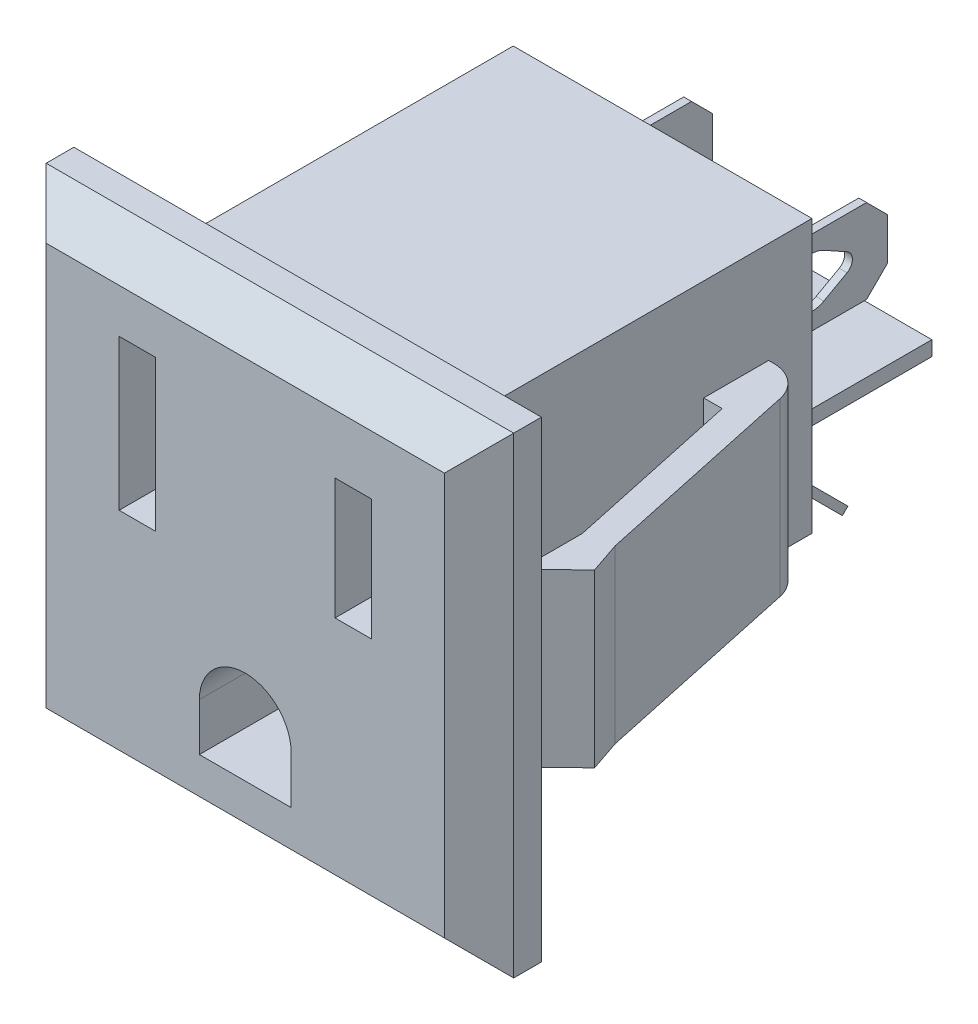
from build123d import *

# Parameters (mm, degrees)
SKETCH1_W           = 27
SKETCH1_H           = 27.25
BOSS_EXTRUDE1_DEPTH = 3.6
CHAMFER1_SIZE       = 2
BOSS_EXTRUDE2_DEPTH = 20.5
CUT_EXTRUDE1_START  = 3.6
SKETCH1_3_W         = 2.1
SKETCH1_3_H         = 8.7
SKETCH1_3_H_2       = 7
CUT_EXTRUDE1_DEPTH  = 22
SKETCH3_W           = 0.45
SKETCH3_H           = 9.6
SKETCH3_W_2         = 9.6
SKETCH3_H_2         = 0.45
BOSS_EXTRUDE3_DEPTH = 1.6
CHAMFER2_SIZE       = 1.5
SKETCH4_W           = 0.45
SKETCH4_H           = 4.85
BOSS_EXTRUDE4_DEPTH = 6.1
BOSS_EXTRUDE5_DEPTH = 2.4
SKETCH6_W           = 13.2
SKETCH6_H           = 0.85
BOSS_EXTRUDE6_DEPTH = 8.95
CHAMFER3_SIZE       = 1.2
CUT_EXTRUDE2_DEPTH  = 38.649057425
CUT_EXTRUDE3_REACH  = 35.476
BOSS_EXTRUDE7_DEPTH = 9.9
FILLET1_R           = 2


with BuildPart() as part:
    # Sketch1 → Boss-Extrude1 (new body)
    with BuildSketch(Plane.XY):
        Rectangle(SKETCH1_W, SKETCH1_H)
    extrude(amount=BOSS_EXTRUDE1_DEPTH)

    # Chamfer1
    chamfer1_edges = [part.edges().sort_by_distance(p)[0] for p in [
        (13.5, 0, 3.6),
        (0, -13.625, 3.6),
        (-13.5, 0, 3.6),
        (0, 13.625, 3.6),
    ]]
    chamfer(chamfer1_edges, length=CHAMFER1_SIZE)

    # Sketch2 → Boss-Extrude2 (add)
    with BuildSketch(Plane(origin=(0, 0, 0), x_dir=(-1, 0, 0), z_dir=(0, 0, -1))):
        Polygon((-8.625, 10.875), (8.625, 10.875), (8.625, -4.875), (4.325, -4.875), (4.325, -11.025), (-4.325, -11.025), (-4.325, -4.875), (-8.625, -4.875), align=None)
    extrude(amount=BOSS_EXTRUDE2_DEPTH)

    # Sketch1<3> → Cut-Extrude1 (cut)
    with BuildSketch(Plane.XY.offset(CUT_EXTRUDE1_START)):
        with Locations((-6.235, 4.725)):
            Rectangle(SKETCH1_3_W, SKETCH1_3_H)
        with Locations((6.235, 4.725)):
            Rectangle(SKETCH1_3_W, SKETCH1_3_H_2)
        with BuildLine():
            Line((2.65, -9.525), (2.65, -6.775))
            ThreePointArc((2.65, -6.775), (0, -4.125), (-2.65, -6.775))
            Line((-2.65, -6.775), (-2.65, -9.525))
            Line((-2.65, -9.525), (2.65, -9.525))
        make_face()
    extrude(amount=-CUT_EXTRUDE1_DEPTH, mode=Mode.SUBTRACT)

    # Sketch3 → Boss-Extrude3 (add)
    with BuildSketch(Plane(origin=(0, 0, -20.5), x_dir=(-1, 0, 0), z_dir=(0, 0, -1))):
        with Locations((-5.055, 4.325)):
            Rectangle(SKETCH3_W, SKETCH3_H)
        with Locations((5.055, 4.325)):
            Rectangle(SKETCH3_W, SKETCH3_H)
        with Locations((0, -4.3)):
            Rectangle(SKETCH3_W_2, SKETCH3_H_2)
    extrude(amount=BOSS_EXTRUDE3_DEPTH)

    # Chamfer2
    chamfer2_edges = [part.edges().sort_by_distance(p)[0] for p in [
        (-5.055, 9.125, -22.1),
        (5.055, 9.125, -22.1),
        (5.055, -0.475, -22.1),
        (-5.055, -0.475, -22.1),
    ]]
    chamfer(chamfer2_edges, length=CHAMFER2_SIZE)

    # Sketch4 → Boss-Extrude4 (add)
    with BuildSketch(Plane(origin=(0, 0, -22.1), x_dir=(-1, 0, 0), z_dir=(0, 0, -1))):
        with Locations((-5.055, 4.325)):
            Rectangle(SKETCH4_W, SKETCH4_H)
        with Locations((5.055, 4.325)):
            Rectangle(SKETCH4_W, SKETCH4_H)
    extrude(amount=BOSS_EXTRUDE4_DEPTH)

    # Sketch5 → Boss-Extrude5 (add, symmetric)
    with BuildSketch(Plane(origin=(0, 0, 0), x_dir=(0, 0, -1), z_dir=(1, 0, 0))):
        Polygon((22.1, -4.075), (29.65, -11.625), (29.331801948, -11.943198052), (21.913603897, -4.525), (22.1, -4.525), align=None)
    extrude(amount=BOSS_EXTRUDE5_DEPTH, both=True)

    # Sketch6 → Boss-Extrude6 (add)
    with BuildSketch(Plane(origin=(0, 0, -20.5), x_dir=(-1, 0, 0), z_dir=(0, 0, -1))):
        with Locations((0, -1.1)):
            Rectangle(SKETCH6_W, SKETCH6_H)
    extrude(amount=BOSS_EXTRUDE6_DEPTH)

    # Chamfer3
    chamfer3_edges = [part.edges().sort_by_distance(p)[0] for p in [
        (5.055, 6.75, -28.2),
        (5.055, 1.9, -28.2),
        (-5.055, 6.75, -28.2),
        (-5.055, 1.9, -28.2),
        (-2.4, -11.784099026, -29.490900974),
        (2.4, -11.784099026, -29.490900974),
    ]]
    chamfer(chamfer3_edges, length=CHAMFER3_SIZE)

    # Sketch7 → Cut-Extrude2 (cut, through all)
    with BuildSketch(Plane(origin=(5.28, 0, 0), x_dir=(0, 0, -1), z_dir=(1, 0, 0))):
        with BuildLine():
            Line((24.534285714, 5.592470565), (25.871428571, 4.849470579))
            ThreePointArc((25.871428571, 4.849470579), (26.18, 4.325), (25.871428571, 3.800529421))
            Line((25.871428571, 3.800529421), (24.534285714, 3.057529435))
            ThreePointArc((24.534285714, 3.057529435), (22.38, 4.325), (24.534285714, 5.592470565))
        make_face()
    extrude(amount=-CUT_EXTRUDE2_DEPTH, mode=Mode.SUBTRACT)

    # Sketch8 → Cut-Extrude3 (cut, up to next)
    with BuildSketch(Plane(origin=(0, 9.0125, -9.0125), x_dir=(1, 0, 0), z_dir=(0, 0.7071067811865465, -0.7071067811865487)), mode=Mode.PRIVATE) as cut_extrude3_sk1:
        with BuildLine():
            Line((-0.524470579, 26.857260965), (-1.267470565, 25.520118108))
            ThreePointArc((-1.267470565, 25.520118108), (0, 23.365832393), (1.267470565, 25.520118108))
            Line((1.267470565, 25.520118108), (0.524470579, 26.857260965))
            ThreePointArc((0.524470579, 26.857260965), (0, 27.165832393), (-0.524470579, 26.857260965))
        make_face()
    cut_extrude3_tool1 = extrude(cut_extrude3_sk1.sketch, amount=-CUT_EXTRUDE3_REACH, mode=Mode.PRIVATE) & part.part
    add(cut_extrude3_tool1.solids().sort_by_distance((0, -8.733008, -26.758008))[0], mode=Mode.SUBTRACT)

    # Sketch9 → Boss-Extrude7 (add)
    with BuildSketch(Plane.XZ.offset(4.875)):
        Polygon((-8.625, -18), (-10.525, -18), (-13.4644015, -4.29921357), (-14.075, -2.5), (-11.9, -0.36), (-11.9, -3.963582901), (-9.693125963, -14.25), (-8.625, -14.25), align=None)
    boss_extrude7 = extrude(amount=-BOSS_EXTRUDE7_DEPTH)

    # Mirror1: Boss-Extrude7 across plane
    add(boss_extrude7.mirror(Plane(origin=(0, 0, 0), x_dir=(0, 0, 1), z_dir=(1, 0, 0))))

    # Fillet1
    fillet1_edges = [part.edges().sort_by_distance(p)[0] for p in [
        (-10.525, 0.075, -18),
        (10.525, 0.075, -18),
    ]]
    fillet(fillet1_edges, radius=FILLET1_R)


solid = part.part
